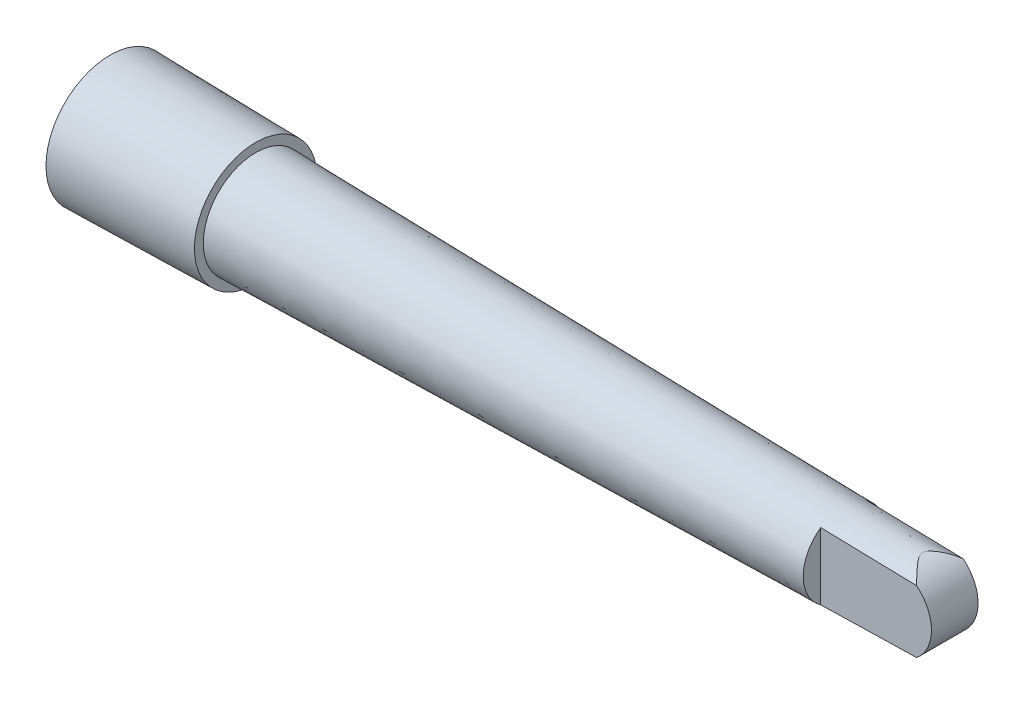
from build123d import *
from build123d.topology import SkipClean

# Parameters (mm, degrees)
BOSS_EXTRUDE3_DEPTH = 1


with BuildPart() as part:
    # Sketch1 → Revolve2 (revolve)
    with BuildSketch(Plane.XY, mode=Mode.PRIVATE) as revolve2_sk:
        Polygon((0, 0), (31.5, 0), (31.5, 1.75), (6.25, 2.25), (6.25, 2.63), (0, 2.75), align=None)
    revolve(revolve2_sk.sketch.rotate(Axis((0, 0, 0), (1, 0, 0)), 90), axis=Axis((0, 0, 0), (1, 0, 0)))

    # Sketch3 → Boss-Extrude3 (add, symmetric)
    with BuildSketch(Plane.XY):
        with BuildLine():
            Line((31.5, 1.75), (34.86, 1.683465347))
            ThreePointArc((34.86, 1.683465347), (36.252723474, 0), (34.86, -1.683465347))
            Line((34.86, -1.683465347), (31.5, -1.75))
            Line((31.5, -1.75), (31.5, 1.75))
        make_face()
    extrude(amount=BOSS_EXTRUDE3_DEPTH, both=True)

    # Sketch9 → Cut-Revolve9 (revolve, cut)
    with SkipClean():  # the faces are left unmerged after this step: merging them gives an invalid solid
        with BuildSketch(Plane.XY):
            Polygon((31.5, 1.75), (31.5, 2.5), (37.130328502, 2.5), (37.130328502, 1.638508346), align=None)
        revolve(axis=Axis((31.5, 0, 0), (1, 0, 0)), mode=Mode.SUBTRACT)

    # Sketch7 → Cut-Revolve8 (revolve, cut)
    with SkipClean():  # the faces are left unmerged after this step: merging them gives an invalid solid
        with BuildSketch(Plane.XY):
            Polygon((31.5, 1.75), (31.5, 2.588823056), (36.825315724, 2.588823056), (36.825315724, 1.644548203), align=None)
        revolve(axis=Axis((31.5, 0, 0), (1, 0, 0)), mode=Mode.SUBTRACT)


solid = part.part
